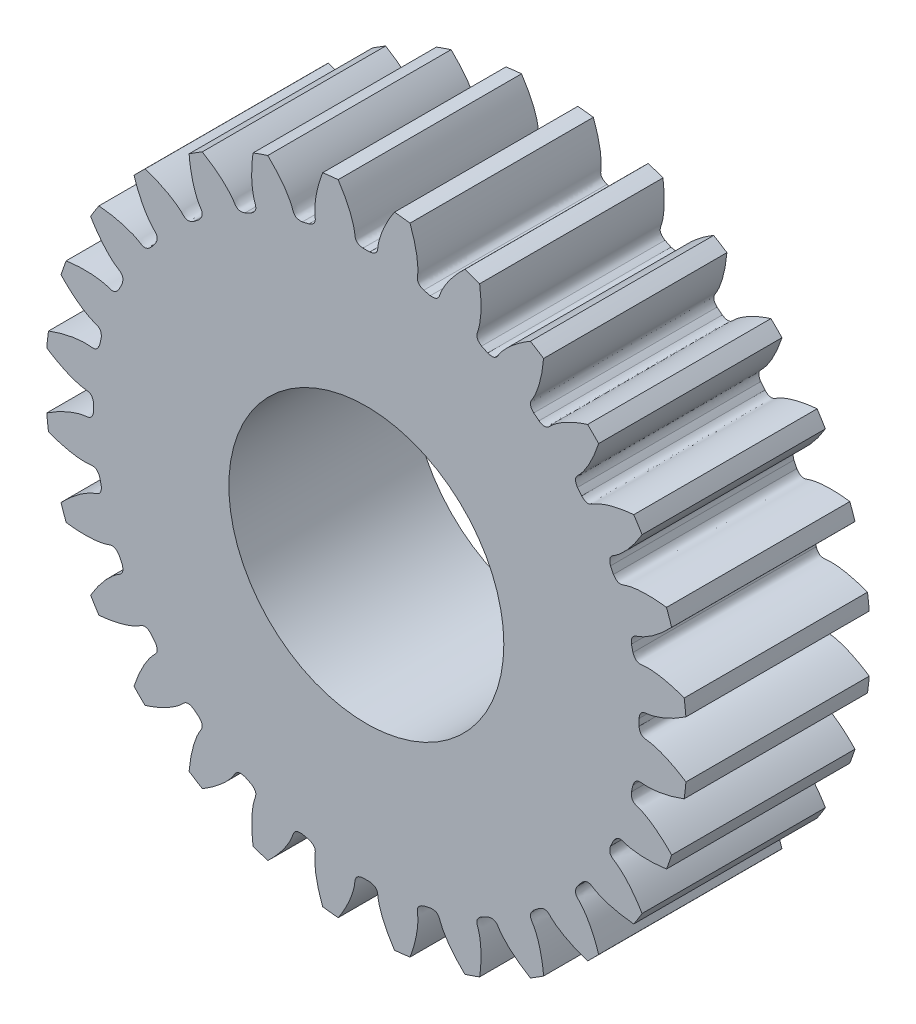
from build123d import *

# Parameters (mm, degrees)
SKETCH_1_R               = 10.5
EXTRUDE_1_DEPTH          = 6
CUT_EXTRUDE_1_DEPTH      = 6
PATTERN_CIRCULAR_1_COUNT = 28
SKETCH_4_R               = 4.5
CUT_EXTRUDE_2_DEPTH      = 16.962524638


with BuildPart() as part:
    # 草图1 → 凸台-拉伸1 (new body)
    with BuildSketch(Plane.XY):
        Circle(SKETCH_1_R)
    extrude(amount=EXTRUDE_1_DEPTH)

    # 草图2 → 切除-拉伸1 (cut)
    with BuildSketch(Plane.XY):
        with BuildLine():
            ThreePointArc((0.109627934, 8.924326681), (0, 8.925), (-0.109627934, 8.924326681))
            add(Edge.make_bspline(
                [(-0.109627934, 8.924326681), (-0.38096135, 8.95975396), (-0.363806826, 9.113075957), (-0.38767547, 9.268178245), (-0.391769514, 9.291770445), (-0.397039859, 9.318891385), (-0.403622198, 9.349503832), (-0.4116602, 9.383564119), (-0.421293349, 9.421025027), (-0.43266073, 9.461834891), (-0.445899678, 9.50593793), (-0.461146057, 9.553274193), (-0.478534022, 9.603779627), (-0.498195953, 9.657386115), (-0.52026233, 9.714021523), (-0.544861631, 9.773609749), (-0.572120226, 9.836070773), (-0.602162269, 9.901320715), (-0.635109596, 9.969271889), (-0.671081623, 10.039832865), (-0.710195244, 10.11290853), (-0.752564733, 10.188400153), (-0.798301646, 10.266205452), (-0.847514726, 10.346218664), (-0.900309803, 10.428330618), (-0.956789712, 10.512428807), (-1.017054191, 10.59839747), (-1.081199801, 10.686117665), (-1.149319833, 10.775467353), (-1.221504226, 10.866321484), (-1.297839486, 10.958552078), (-1.378408601, 11.052028318), (-1.463290964, 11.146616635), (-1.552562298, 11.242180803), (-1.64629458, 11.338582033), (-1.744555971, 11.435679066), (-1.847410749, 11.533328273), (-1.954919213, 11.631383754), (-2.106391148, 11.764086996), (-2.22440364, 11.861306618), (-2.305274246, 11.925320906)],
                knots=[0, 0, 0, 0, 0.112672291, 0.1180235, 0.124347656, 0.131644759, 0.139914809, 0.149157806, 0.15937375, 0.170562641, 0.182724479, 0.195859265, 0.209966997, 0.225047676, 0.241101302, 0.258127876, 0.276127396, 0.295099864, 0.315045278, 0.33596364, 0.357854948, 0.380719204, 0.404556407, 0.429366557, 0.455149653, 0.481905697, 0.509634688, 0.538336626, 0.568011511, 0.598659343, 0.630280122, 0.662873848, 0.696440521, 0.730980141, 0.766492709, 0.802978223, 0.840436684, 0.878868093, 0.918272448, 1, 1, 1, 1], degree=3))
            ThreePointArc((-2.305274246, 11.925320906), (0, 12.146092707), (2.305274246, 11.925320906))
            add(Edge.make_bspline(
                [(0.109627934, 8.924326681), (0.38096135, 8.95975396), (0.363806826, 9.113075957), (0.38767547, 9.268178245), (0.391769514, 9.291770445), (0.397039859, 9.318891385), (0.403622198, 9.349503832), (0.4116602, 9.383564119), (0.421293349, 9.421025027), (0.43266073, 9.461834891), (0.445899678, 9.50593793), (0.461146057, 9.553274193), (0.478534022, 9.603779627), (0.498195953, 9.657386115), (0.52026233, 9.714021523), (0.544861631, 9.773609749), (0.572120226, 9.836070773), (0.602162269, 9.901320715), (0.635109596, 9.969271889), (0.671081623, 10.039832865), (0.710195244, 10.11290853), (0.752564733, 10.188400153), (0.798301646, 10.266205452), (0.847514726, 10.346218664), (0.900309803, 10.428330618), (0.956789712, 10.512428807), (1.017054191, 10.59839747), (1.081199801, 10.686117665), (1.149319833, 10.775467353), (1.221504226, 10.866321484), (1.297839486, 10.958552078), (1.378408601, 11.052028318), (1.463290964, 11.146616635), (1.552562298, 11.242180803), (1.64629458, 11.338582033), (1.744555971, 11.435679066), (1.847410749, 11.533328273), (1.954919213, 11.631383754), (2.106391148, 11.764086996), (2.22440364, 11.861306618), (2.305274246, 11.925320906)],
                knots=[0, 0, 0, 0, 0.112672291, 0.1180235, 0.124347656, 0.131644759, 0.139914809, 0.149157806, 0.15937375, 0.170562641, 0.182724479, 0.195859265, 0.209966997, 0.225047676, 0.241101302, 0.258127876, 0.276127396, 0.295099864, 0.315045278, 0.33596364, 0.357854948, 0.380719204, 0.404556407, 0.429366557, 0.455149653, 0.481905697, 0.509634688, 0.538336626, 0.568011511, 0.598659343, 0.630280122, 0.662873848, 0.696440521, 0.730980141, 0.766492709, 0.802978223, 0.840436684, 0.878868093, 0.918272448, 1, 1, 1, 1], degree=3))
        make_face()
    cut_extrude_1 = extrude(amount=CUT_EXTRUDE_1_DEPTH, mode=Mode.SUBTRACT)

    # 阵列(圆周)1: 切除-拉伸1 ×28 about axis
    pattern_circular_1_axis = Axis((0, 0, -11.55), (0, 0, 1))
    for i in range(1, PATTERN_CIRCULAR_1_COUNT):
        add(cut_extrude_1.rotate(pattern_circular_1_axis, i * 360 / PATTERN_CIRCULAR_1_COUNT), mode=Mode.SUBTRACT)

    # 草图4 → 切除-拉伸2 (cut, through all)
    with BuildSketch(Plane.XY.offset(6)):
        Circle(SKETCH_4_R)
    extrude(amount=-CUT_EXTRUDE_2_DEPTH, mode=Mode.SUBTRACT)


solid = part.part
